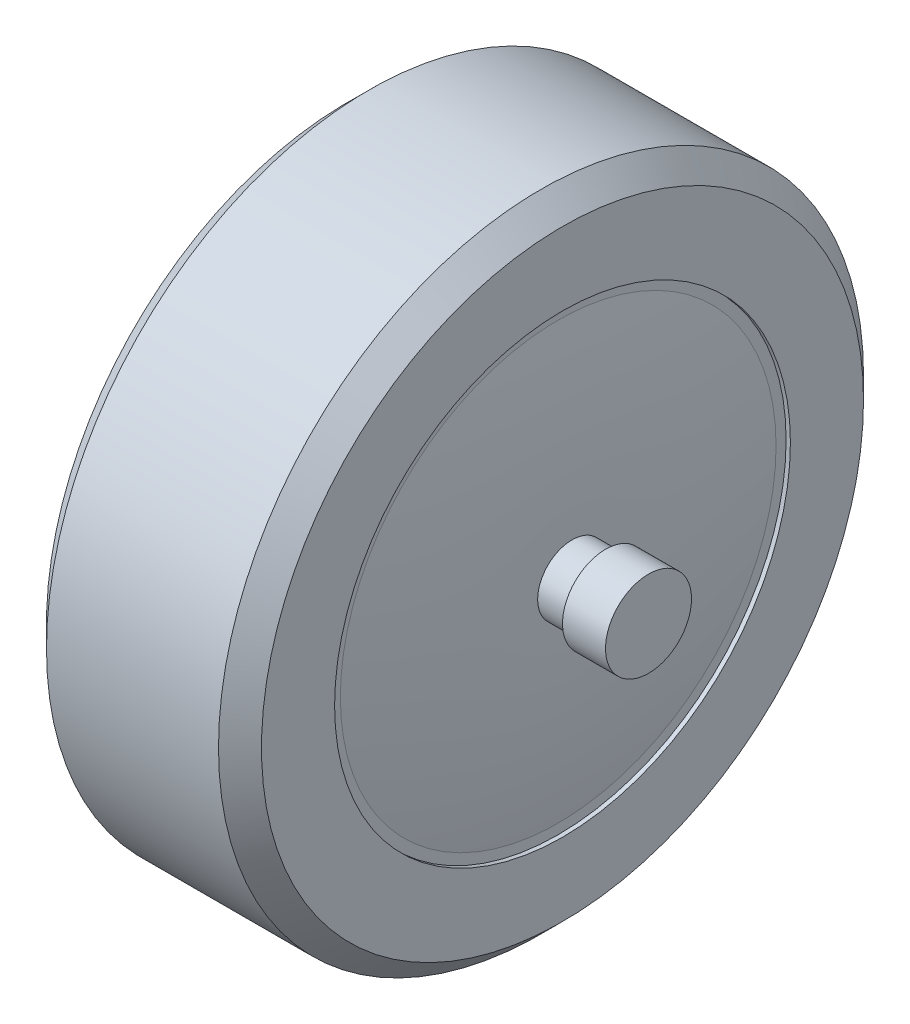
from build123d import *

# Parameters (mm, degrees)
SKETCH1_R           = 75
BOSS_EXTRUDE1_DEPTH = 25
SKETCH2_R           = 8
BOSS_EXTRUDE2_DEPTH = 35
SKETCH3_R           = 10
BOSS_EXTRUDE3_DEPTH = 10
CHAMFER1_SIZE       = 5
SKETCH4_R           = 53
SKETCH4_R_2         = 8
CUT_EXTRUDE1_DEPTH  = 1


with BuildPart() as part:
    # Sketch1 → Boss-Extrude1 (new, symmetric)
    with BuildSketch(Plane(origin=(0, 0, 0), x_dir=(0, 0, -1), z_dir=(1, 0, 0))):
        Circle(SKETCH1_R)
    extrude(amount=BOSS_EXTRUDE1_DEPTH, both=True)

    # Sketch2 → Boss-Extrude2 (add, symmetric)
    with BuildSketch(Plane(origin=(0, 0, 0), x_dir=(0, 0, -1), z_dir=(1, 0, 0))):
        Circle(SKETCH2_R)
    extrude(amount=BOSS_EXTRUDE2_DEPTH, both=True)

    # Sketch3 → Boss-Extrude3 (add)
    with BuildSketch(Plane(origin=(35, 0, 0), x_dir=(0, 0, -1), z_dir=(1, 0, 0))):
        Circle(SKETCH3_R)
    boss_extrude3 = extrude(amount=BOSS_EXTRUDE3_DEPTH)

    # Mirror1: Boss-Extrude3 across plane
    add(boss_extrude3.mirror(Plane(origin=(0, 0, 0), x_dir=(0, 0, 1), z_dir=(1, 0, 0))))

    # Chamfer1
    chamfer1_edges = [part.edges().sort_by_distance(p)[0] for p in [
        (-25, 0, 75),
        (25, 0, 75),
    ]]
    chamfer(chamfer1_edges, length=CHAMFER1_SIZE)

    # Sketch4 → Cut-Extrude1 (cut)
    with BuildSketch(Plane(origin=(25, 0, 0), x_dir=(0, 0, -1), z_dir=(1, 0, 0))):
        Circle(SKETCH4_R)
        Circle(SKETCH4_R_2, mode=Mode.SUBTRACT)
    cut_extrude1 = extrude(amount=-CUT_EXTRUDE1_DEPTH, mode=Mode.SUBTRACT)

    # Mirror2: Cut-Extrude1 across plane
    add(cut_extrude1.mirror(Plane(origin=(0, 0, 0), x_dir=(0, 0, 1), z_dir=(1, 0, 0))), mode=Mode.SUBTRACT)

    # Sketch5 → Revolve1 (revolve)
    with BuildSketch(Plane(origin=(0, 0, 0), x_dir=(1, 0, 0), z_dir=(0, 1, 0))):
        with BuildLine():
            Line((24, 0), (24, 50.661166178))
            add(Edge.make_bspline(
                [(27, 0), (28.099596194, 25.463923128), (24, 50.661166178)],
                knots=[0, 0, 0, 1, 1, 1], degree=2))
            Line((27, 0), (24, 0))
        make_face()
    revolve1 = revolve(axis=Axis((27, 0, 0), (1, 0, 0)))

    # Mirror3: Revolve1 across plane
    add(revolve1.mirror(Plane(origin=(0, 0, 0), x_dir=(0, 0, 1), z_dir=(1, 0, 0))))


solid = part.part
